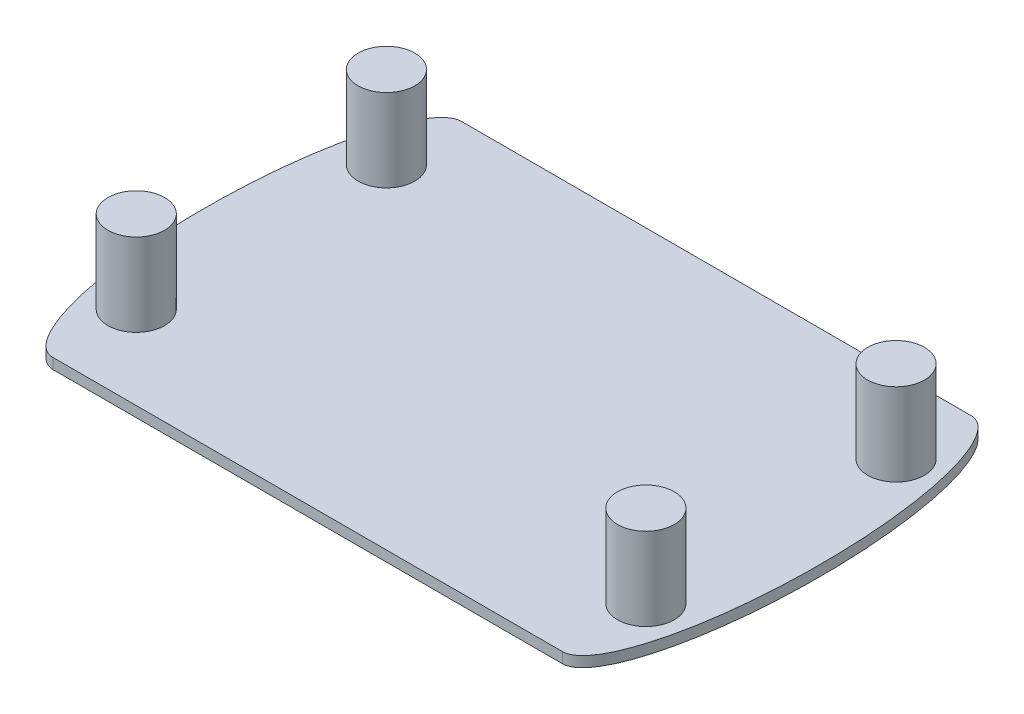
from build123d import *

# Parameters (mm, degrees)
ESBO_O1_R                  = 3.4
RESSALTO_EXTRUS_O1_DEPTH   = 9.9
RESSALTO_EXTRUS_O1_2_DEPTH = 9.9
RESSALTO_EXTRUS_O1_3_DEPTH = 9.9
RESSALTO_EXTRUS_O1_4_DEPTH = 9.9
ESBO_O3_RX                 = 24.5
ESBO_O3_RY                 = 6.4005522
ESBO_O3_W                  = 61.1
ESBO_O3_H                  = 49
RESSALTO_EXTRUS_O2_DEPTH   = 1.26


with BuildPart() as part:
    # Esboço1 → Ressalto-extrusão1 (new body)
    with BuildSketch(Plane(origin=(0, 0, 0), x_dir=(1, 0, 0), z_dir=(0, 1, 0))):
        with Locations(Location((-30.55, 30, 0), (0, 0, 90))):
            Circle(ESBO_O1_R)
    extrude(amount=RESSALTO_EXTRUS_O1_DEPTH)



with BuildPart() as body_2:
    # Esboço1 → Ressalto-extrus_o1 2 (new body)
    with BuildSketch(Plane(origin=(0, 0, 0), x_dir=(1, 0, 0), z_dir=(0, 1, 0))):
        with Locations(Location((-30.55, 0, 0), (0, 0, 90))):
            Circle(ESBO_O1_R)
    extrude(amount=RESSALTO_EXTRUS_O1_2_DEPTH)


with BuildPart() as body_3:
    # Esboço1 → Ressalto-extrus_o1 3 (new body)
    with BuildSketch(Plane(origin=(0, 0, 0), x_dir=(1, 0, 0), z_dir=(0, 1, 0))):
        with Locations(Location((30.55, 0, 0), (0, 0, 90))):
            Circle(ESBO_O1_R)
    extrude(amount=RESSALTO_EXTRUS_O1_3_DEPTH)


with BuildPart() as body_4:
    # Esboço1 → Ressalto-extrus_o1 4 (new body)
    with BuildSketch(Plane(origin=(0, 0, 0), x_dir=(1, 0, 0), z_dir=(0, 1, 0))):
        with Locations(Location((30.55, 30, 0), (0, 0, 90))):
            Circle(ESBO_O1_R)
    extrude(amount=RESSALTO_EXTRUS_O1_4_DEPTH)


with BuildPart() as part_1:
    add(part.part)

    add(body_2.part)  # Ressalto-extrusão2 merges body 2

    add(body_3.part)  # Ressalto-extrusão2 merges body 3

    add(body_4.part)  # Ressalto-extrusão2 merges body 4
    # Esboço3 → Ressalto-extrusão2 (add)
    with BuildSketch(Plane(origin=(0, 0, 0), x_dir=(1, 0, 0), z_dir=(0, 1, 0))):
        with Locations(Location((-30.55, 14.5), (0, 0, 90))):
            Ellipse(ESBO_O3_RX, ESBO_O3_RY)
        with Locations(Location((30.55, 14.5), (0, 0, 90))):
            Ellipse(ESBO_O3_RX, ESBO_O3_RY)
        with Locations((0, 14.5)):
            Rectangle(ESBO_O3_W, ESBO_O3_H)
    extrude(amount=-RESSALTO_EXTRUS_O2_DEPTH)


solid = part_1.part
